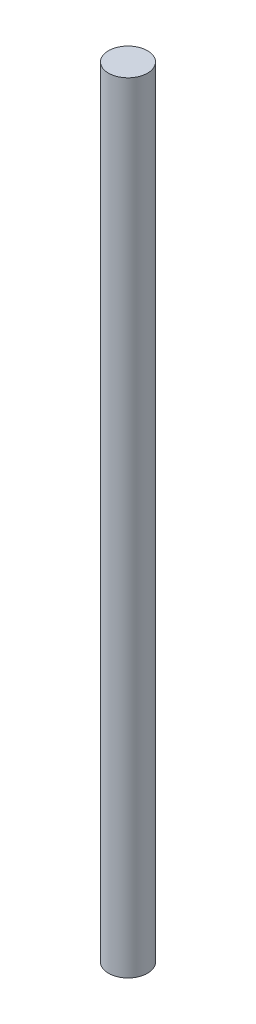
from build123d import *

# Parameters (mm, degrees)
SKETCH1_R      = 10
EXTRUDE1_DEPTH = 400


with BuildPart() as part:
    # Sketch1 → Extrude1 (new body)
    with BuildSketch(Plane(origin=(0, 0, 0), x_dir=(1, 0, 0), z_dir=(0, 1, 0))):
        with Locations(Location((0, 0, 0), (0, 0, 270))):
            Circle(SKETCH1_R)
    extrude(amount=EXTRUDE1_DEPTH)


solid = part.part
